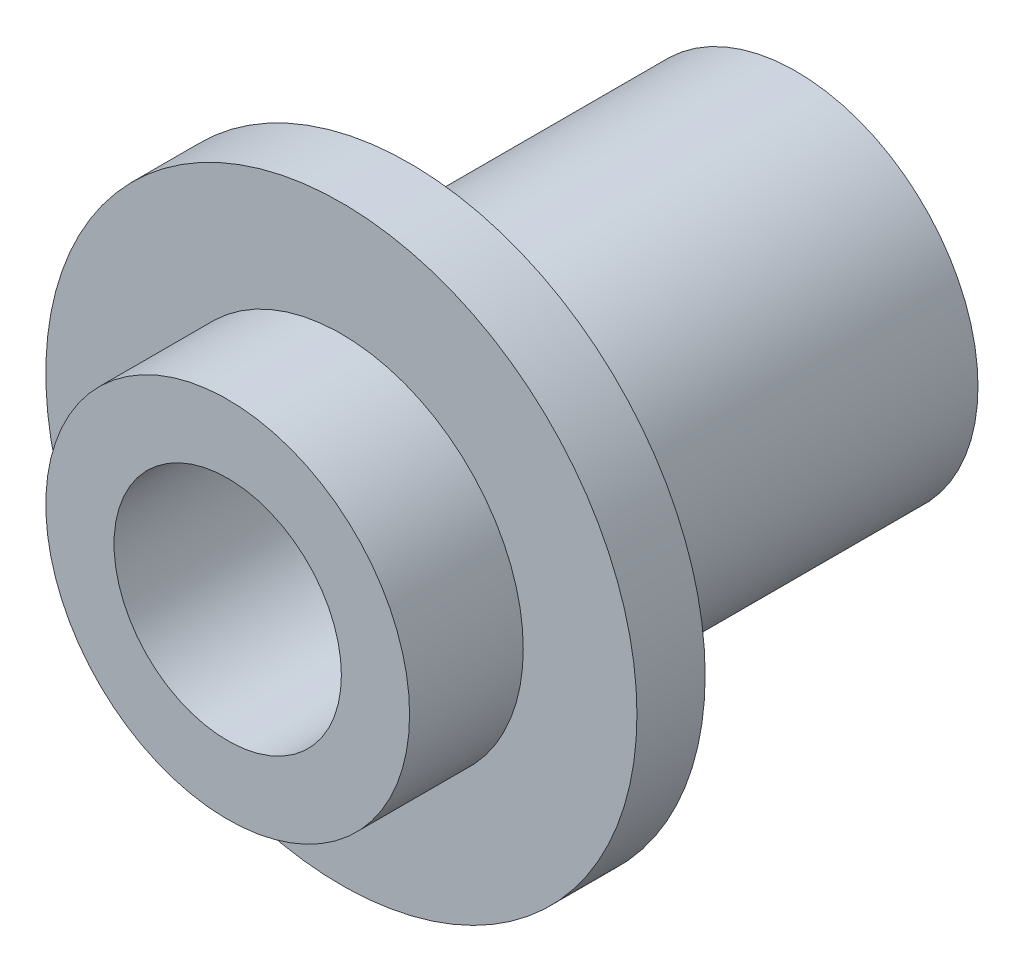
from build123d import *


with BuildPart() as part:
    # Sketch1 → Revolve1 (revolve)
    with BuildSketch(Plane(origin=(0, 0, 0), x_dir=(0, 0, -1), z_dir=(1, 0, 0)), mode=Mode.PRIVATE) as revolve1_sk:
        Polygon((-5, 5), (-5, 8), (0, 8), (0, 13), (3, 13), (3, 8), (20, 8), (20, 5), align=None)
    revolve(revolve1_sk.sketch.rotate(Axis((0, 0, 30), (0, 0, -1)), 90), axis=Axis((0, 0, 30), (0, 0, -1)))


solid = part.part
